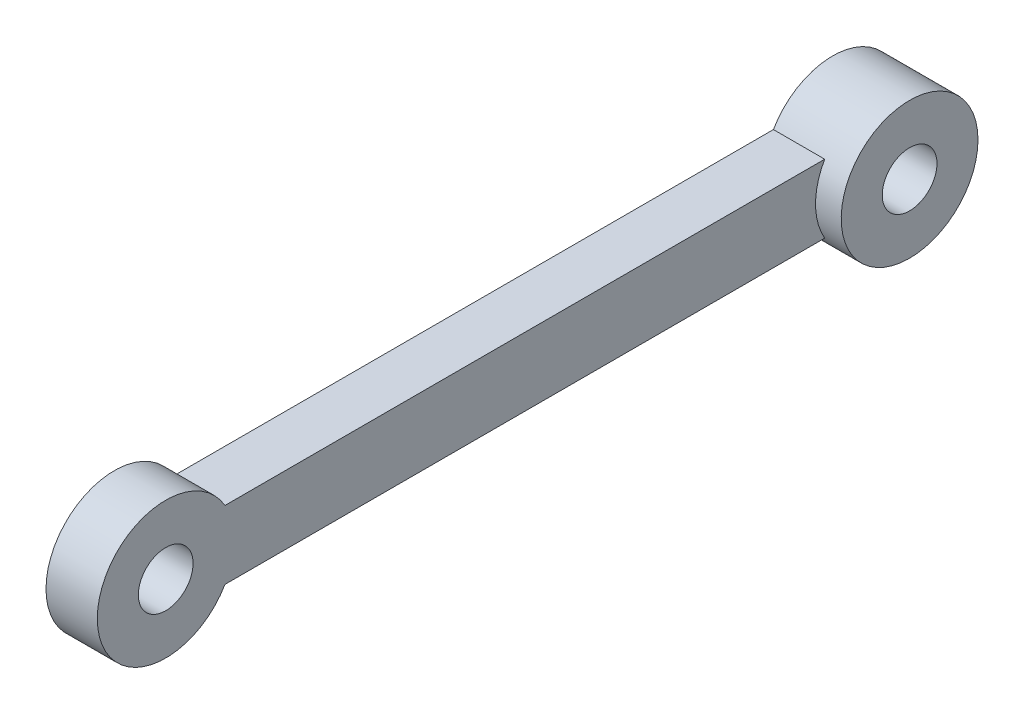
from build123d import *

# Parameters (mm, degrees)
SKETCH1_R           = 1.6
BOSS_EXTRUDE1_DEPTH = 3
SKETCH3_R           = 4
SKETCH3_R_2         = 1.6
BOSS_EXTRUDE3_DEPTH = 1.5


with BuildPart() as part:
    # Sketch1 → Boss-Extrude1 (new body)
    with BuildSketch(Plane(origin=(0, 0, 0), x_dir=(0, 0, -1), z_dir=(1, 0, 0))):
        with BuildLine():
            Line((21, 2), (38.535898385, 2))
            ThreePointArc((38.535898385, 2), (46, 0), (38.535898385, -2))
            Line((38.535898385, -2), (21, -2))
            Line((21, -2), (3.464101615, -2))
            ThreePointArc((3.464101615, -2), (-4, 0), (3.464101615, 2))
            Line((3.464101615, 2), (21, 2))
        make_face()
        Circle(SKETCH1_R, mode=Mode.SUBTRACT)
        with Locations((42, 0)):
            Circle(SKETCH1_R, mode=Mode.SUBTRACT)
    extrude(amount=BOSS_EXTRUDE1_DEPTH)

    # Sketch3 → Boss-Extrude3 (add)
    with BuildSketch(Plane(origin=(3, 0, 0), x_dir=(0, 0, -1), z_dir=(1, 0, 0))):
        with Locations(Location((42, 0, 0), (0, 0, 150))):
            Circle(SKETCH3_R)
        with Locations((42, 0)):
            Circle(SKETCH3_R_2, mode=Mode.SUBTRACT)
    extrude(amount=BOSS_EXTRUDE3_DEPTH)


solid = part.part
